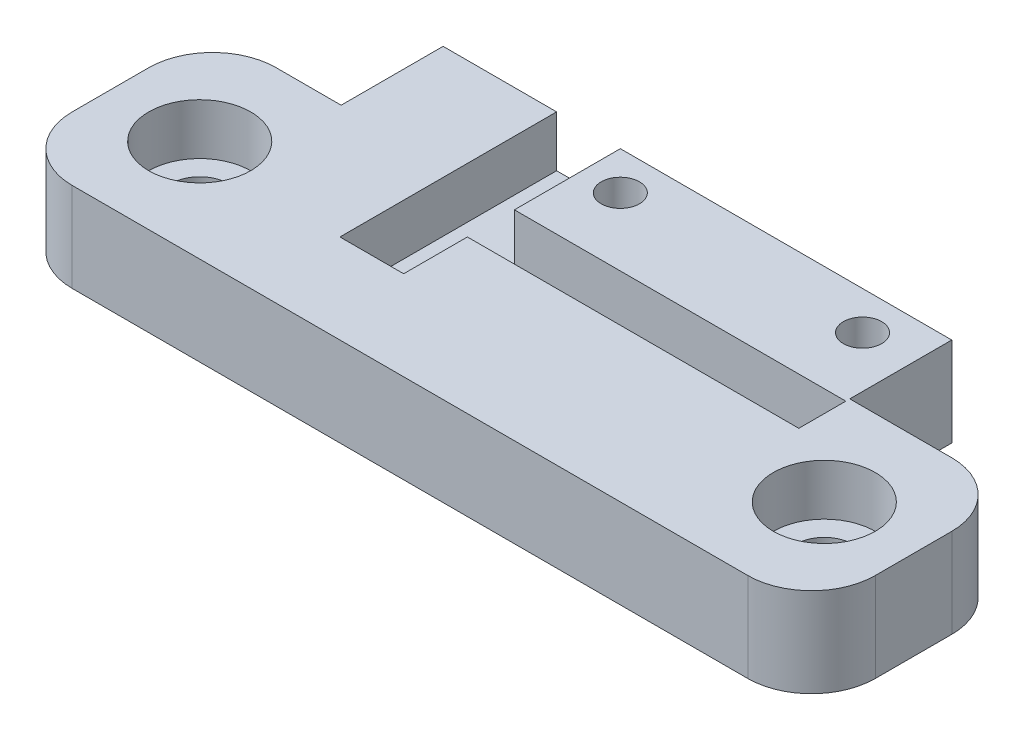
from build123d import *

# Parameters (mm, degrees)
EXTRUDE_1_DEPTH     = 7
SKETCH_2_R          = 2.25
CUT_EXTRUDE_1_DEPTH = 47
SKETCH_3_W          = 33
SKETCH_3_H          = 6
EXTRUDE_2_DEPTH     = 4
CUT_EXTRUDE_2_DEPTH = 4
SKETCH_5_3_R        = 1.5
CUT_EXTRUDE_3_DEPTH = 20
CUT_EXTRUDE_4_DEPTH = 2
FILLET_1_R          = 5
SKETCH_7_R          = 4
CUT_EXTRUDE_5_DEPTH = 4


with BuildPart() as part:
    # Эскиз1 → Бобышка-Вытянуть1 (new body)
    with BuildSketch(Plane(origin=(0, 0, 0), x_dir=(1, 0, 0), z_dir=(0, 1, 0))):
        Polygon((0, 16), (0, 0), (63, 0), (63, 16), (50, 16), (50, 24), (10.095388493, 24), (10.095388493, 16), align=None)
    extrude(amount=EXTRUDE_1_DEPTH)

    # Эскиз2 → Вырез-Вытянуть1 (cut)
    with BuildSketch(Plane(origin=(0, 0, 0), x_dir=(1, 0, 0), z_dir=(0, 1, 0))):
        with Locations((7, 8)):
            Circle(SKETCH_2_R)
        with Locations((56, 8)):
            Circle(SKETCH_2_R)
    extrude(amount=CUT_EXTRUDE_1_DEPTH, mode=Mode.SUBTRACT)

    # Эскиз3 → Бобышка-Вытянуть2 (add)
    with BuildSketch(Plane.XZ):
        with Locations((31.5, -8)):
            Rectangle(SKETCH_3_W, SKETCH_3_H)
    extrude(amount=EXTRUDE_2_DEPTH)

    # Эскиз5 → Вырез-Вытянуть2 (cut)
    with BuildSketch(Plane(origin=(0, 7, 0), x_dir=(1, 0, 0), z_dir=(0, 1, 0))):
        Polygon((50, 12), (50, 15.69), (24, 15.69), (24, 24), (19, 24), (19, 7), (24, 7), (24, 12), align=None)
    extrude(amount=-CUT_EXTRUDE_2_DEPTH, mode=Mode.SUBTRACT)

    # Эскиз5<3> → Вырез-Вытянуть3 (cut)
    with BuildSketch(Plane(origin=(0, 7, 0), x_dir=(1, 0, 0), z_dir=(0, 1, 0))):
        with Locations((46, 21)):
            Circle(SKETCH_5_3_R)
        with Locations((27, 21)):
            Circle(SKETCH_5_3_R)
    extrude(amount=-CUT_EXTRUDE_3_DEPTH, mode=Mode.SUBTRACT)

    # Эскиз6 → Вырез-Вытянуть4 (cut)
    with BuildSketch(Plane.XZ):
        Polygon((47.732050808, -18), (44.267949192, -18), (42.535898385, -21), (44.267949192, -24), (47.732050808, -24), (49.464101615, -21), align=None)
        Polygon((30.464101615, -21), (28.732050808, -18), (25.267949192, -18), (23.535898385, -21), (25.267949192, -24), (28.732050808, -24), align=None)
    extrude(amount=-CUT_EXTRUDE_4_DEPTH, mode=Mode.SUBTRACT)

    # Скругление1
    fillet_1_edges = [part.edges().sort_by_distance(p)[0] for p in [
        (0, 3.5, -16),
        (0, 3.5, 0),
        (63, 3.5, 0),
        (63, 3.5, -16),
    ]]
    fillet(fillet_1_edges, radius=FILLET_1_R)

    # Эскиз7 → Вырез-Вытянуть5 (cut)
    with BuildSketch(Plane(origin=(0, 7, 0), x_dir=(1, 0, 0), z_dir=(0, 1, 0))):
        with Locations((7, 8)):
            Circle(SKETCH_7_R)
        with Locations((56, 8)):
            Circle(SKETCH_7_R)
    extrude(amount=-CUT_EXTRUDE_5_DEPTH, mode=Mode.SUBTRACT)


solid = part.part
